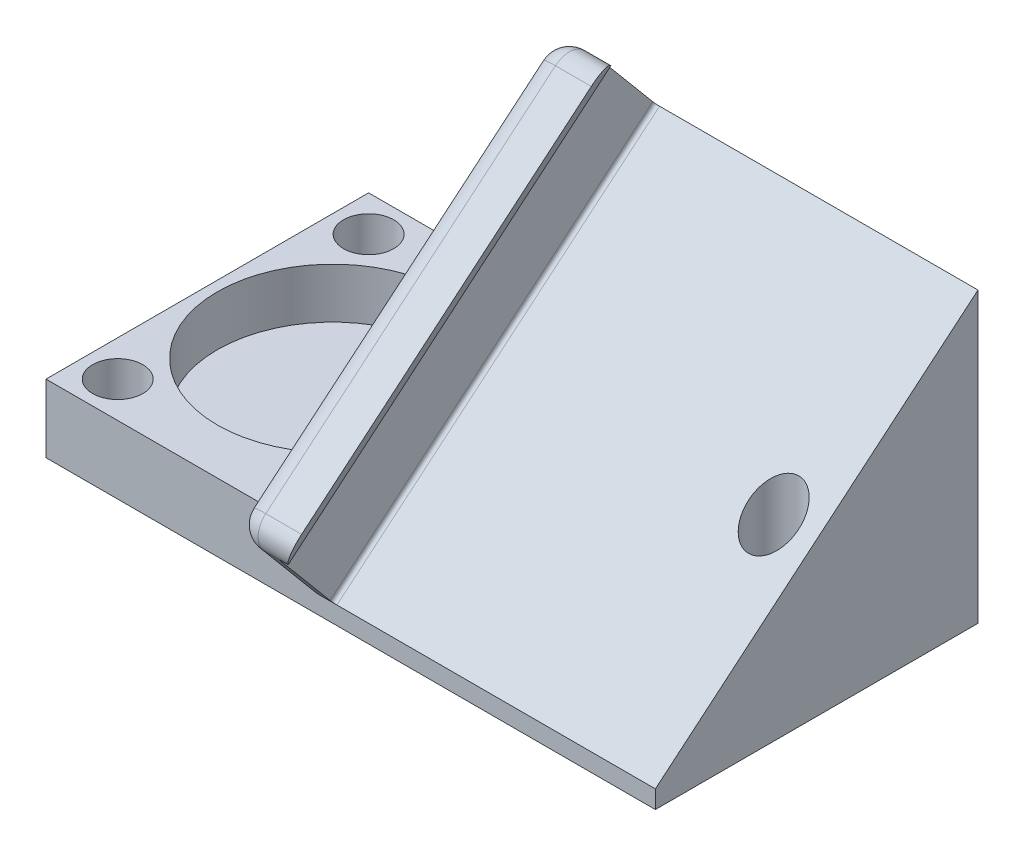
from build123d import *

# Parameters (mm, degrees)
SKETCH1_W           = 85
SKETCH1_H           = 45
BOSS_EXTRUDE1_DEPTH = 2.5
BOSS_EXTRUDE2_DEPTH = 50
BOSS_EXTRUDE3_DEPTH = 58.743328
SKETCH4_W           = 35
SKETCH4_H           = 45
SKETCH4_R           = 16.1
BOSS_EXTRUDE4_DEPTH = 7
HOLE1_D             = 4.2
HOLE1_DEPTH         = 20
HOLE1_CBORE_D       = 7
HOLE1_CBORE_DEPTH   = 5
FILLET4_R           = 3
FILLET5_R           = 3
FILLET6_R           = 3
FILLET7_R           = 0.58


with BuildPart() as part:
    # Sketch1 → Boss-Extrude1 (new body)
    with BuildSketch(Plane(origin=(0, 0, 0), x_dir=(1, 0, 0), z_dir=(0, 1, 0))):
        with Locations((-42.5, 22.5)):
            Rectangle(SKETCH1_W, SKETCH1_H)
    extrude(amount=BOSS_EXTRUDE1_DEPTH)

    # Sketch2 → Boss-Extrude2 (add)
    with BuildSketch(Plane(origin=(0, 0, 0), x_dir=(0, 0, -1), z_dir=(1, 0, 0))):
        Polygon((0, 2.5), (45, 40.259483403), (45, 2.5), align=None)
    extrude(amount=-BOSS_EXTRUDE2_DEPTH)

    # Sketch3 → Boss-Extrude3 (add)
    with BuildSketch(Plane(origin=(-50, 40.259483403, -45), x_dir=(1, 0, 0), z_dir=(0, -0.6427876096865354, 0.7660444431189815))):
        Polygon((0, 0), (0, 15), (8, 15), (6.5, 12), (5, 12), (5, 0), align=None)
    extrude(amount=BOSS_EXTRUDE3_DEPTH)

    # Sketch4 → Boss-Extrude4 (add)
    with BuildSketch(Plane(origin=(0, 2.5, 0), x_dir=(1, 0, 0), z_dir=(0, 1, 0))):
        with Locations((-67.5, 22.5)):
            Rectangle(SKETCH4_W, SKETCH4_H)
        with Locations(Location((-67.5, 22.5, 0), (0, 0, 270))):
            Circle(SKETCH4_R, mode=Mode.SUBTRACT)
    extrude(amount=BOSS_EXTRUDE4_DEPTH)

    # Hole1
    with Locations(Plane(origin=(-80, 9.5, -40), x_dir=(0, 0, 1), z_dir=(0, 1, 0))):
        with Locations((0, 0), (35, 0)):
            CounterBoreHole(HOLE1_D / 2, HOLE1_CBORE_D / 2, HOLE1_CBORE_DEPTH, depth=HOLE1_DEPTH)

    # Sketch8 → Cut-Revolve1 (revolve, cut)
    with BuildSketch(Plane.XY.offset(-22.5), mode=Mode.PRIVATE) as cut_revolve1_sk:
        Polygon((-2.5, 21.379741701), (-2.5, 6), (-3.9, 6), (-3.9, -6.519563006), (-6, -6.519563006), (-6, 21.379741701), (-6, 29.263564953), (-2.5, 29.263564953), align=None)
    revolve(cut_revolve1_sk.sketch.rotate(Axis((-6, -6.519563006, -22.5), (0, 1, 0)), 90), axis=Axis((-6, -6.519563006, -22.5), (0, 1, 0)), mode=Mode.SUBTRACT)

    # Fillet4
    fillet4_edges = [part.edges().sort_by_distance(p)[0] for p in [
        (-50, 32.870408355, -12.858185862),
    ]]
    fillet(fillet4_edges, radius=FILLET4_R)

    # Fillet5
    fillet5_edges = [part.edges().sort_by_distance(p)[0] for p in [
        (-44.5, 51.75015005, -35.358185855),
        (-49.121320344, 51.077042382, -35.922990251),
        (-50, 44.855750062, -41.143274342),
        (-50, 24.879741701, -45),
    ]]
    fillet(fillet5_edges, radius=FILLET5_R)

    # Fillet6
    fillet6_edges = [part.edges().sort_by_distance(p)[0] for p in [
        (-44.5, 13.99066666, 9.64181413),
        (-49.121320344, 13.317558992, 9.077009734),
        (-50, 7.096266672, 3.856725643),
    ]]
    fillet(fillet6_edges, radius=FILLET6_R)

    # Fillet7
    fillet7_edges = [part.edges().sort_by_distance(p)[0] for p in [
        (-45, 21.379741708, -22.500000008),
        (-45, 30.572275025, -14.786548691),
    ]]
    fillet(fillet7_edges, radius=FILLET7_R)


solid = part.part
